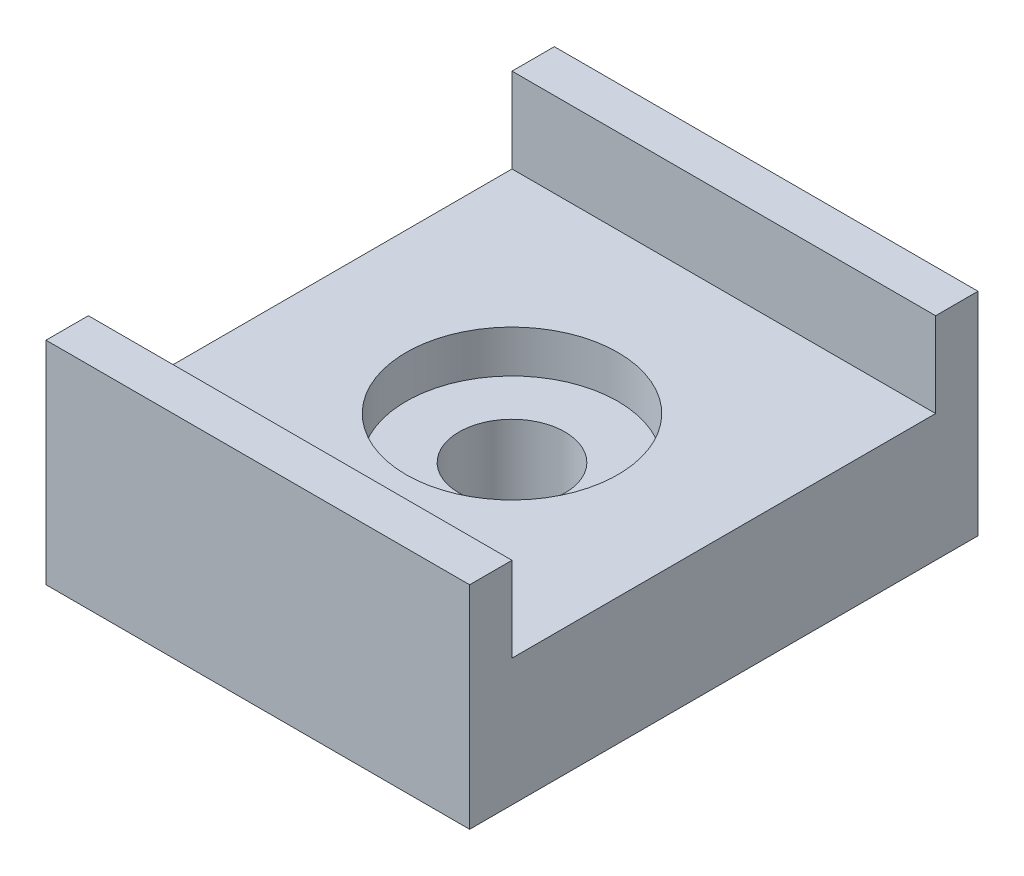
from build123d import *

# Parameters (mm, degrees)
BOSS_EXTRUDE1_DEPTH = 25.4
SKETCH2_R           = 3.175
CUT_EXTRUDE1_DEPTH  = 41.40117325
SKETCH3_R           = 6.35
CUT_EXTRUDE2_DEPTH  = 2.54


with BuildPart() as part:
    # Sketch1 → Boss-Extrude1 (new body)
    with BuildSketch(Plane(origin=(0, 0, 0), x_dir=(0, 0, -1), z_dir=(1, 0, 0))):
        Polygon((27.94, 12.7), (30.48, 12.7), (30.48, 0), (0, 0), (0, 12.7), (2.54, 12.7), (2.54, 7.62), (27.94, 7.62), align=None)
    extrude(amount=BOSS_EXTRUDE1_DEPTH)

    # Sketch2 → Cut-Extrude1 (cut, through all)
    with BuildSketch(Plane(origin=(0, 7.62, 0), x_dir=(1, 0, 0), z_dir=(0, 1, 0))):
        with Locations(Location((12.7, 15.24, 0), (0, 0, 270))):
            Circle(SKETCH2_R)
    extrude(amount=-CUT_EXTRUDE1_DEPTH, mode=Mode.SUBTRACT)

    # Sketch3 → Cut-Extrude2 (cut)
    with BuildSketch(Plane(origin=(0, 7.62, 0), x_dir=(1, 0, 0), z_dir=(0, 1, 0))):
        with Locations(Location((12.7, 15.24, 0), (0, 0, 270))):
            Circle(SKETCH3_R)
    extrude(amount=-CUT_EXTRUDE2_DEPTH, mode=Mode.SUBTRACT)


solid = part.part
